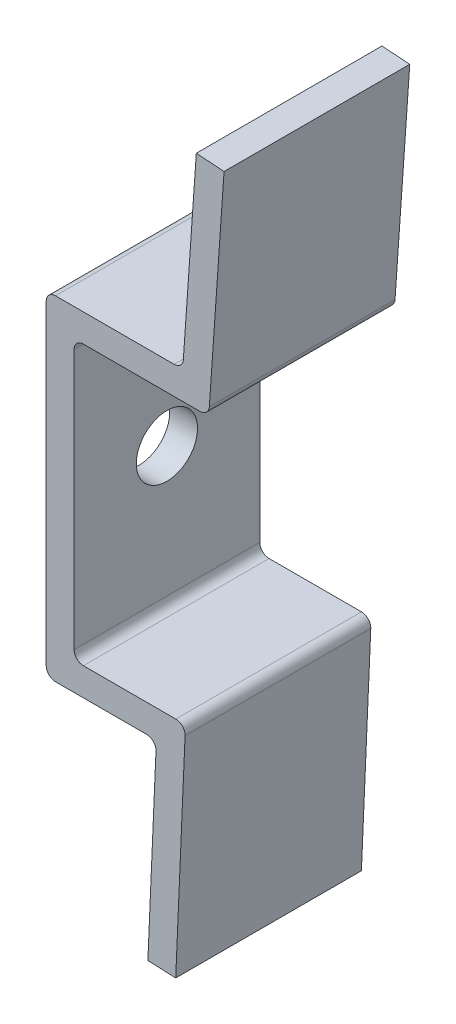
from build123d import *

# Parameters (mm, degrees)
EXTRUDE_1_DEPTH      = 10
EXTRUDE_1_DEPTH_BACK = 10
HOLE_WIZARD_M61_D    = 6.6


with BuildPart() as part:
    # Эскиз1 → Бобышка-Вытянуть1 (new, two sides: drawn at the far end of the back side and taken through both)
    with BuildSketch(Plane.XY.offset(-EXTRUDE_1_DEPTH_BACK)):
        with BuildLine():
            Line((0, 17), (0, -17))
            ThreePointArc((0, -17), (0.292893219, -17.707106781), (1, -18))
            Line((1, -18), (10.821545488, -18))
            ThreePointArc((10.821545488, -18), (11.54390945, -18.308486944), (11.820593709, -19.043619387))
            Line((11.820593709, -19.043619387), (10.948205962, -39.024583819))
            Line((10.948205962, -39.024583819), (13.945350627, -39.155441981))
            Line((13.945350627, -39.155441981), (14.954434594, -16.043619387))
            ThreePointArc((14.954434594, -16.043619387), (14.677750334, -15.308486944), (13.955386372, -15))
            Line((13.955386372, -15), (4, -15))
            ThreePointArc((4, -15), (3.292893219, -14.707106781), (3, -14))
            Line((3, -14), (3, 14))
            ThreePointArc((3, 14), (3.292893219, 14.707106781), (4, 15))
            Line((4, 15), (16.567484914, 15))
            ThreePointArc((16.567484914, 15), (17.249483274, 15.268646298), (17.565048964, 15.930243526))
            Line((17.565048964, 15.930243526), (19.155325331, 38.67225511))
            Line((19.155325331, 38.67225511), (16.162633181, 38.881524531))
            Line((16.162633181, 38.881524531), (14.767503706, 18.930243526))
            ThreePointArc((14.767503706, 18.930243526), (14.451938016, 18.268646298), (13.769939655, 18))
            Line((13.769939655, 18), (1, 18))
            ThreePointArc((1, 18), (0.292893219, 17.707106781), (0, 17))
        make_face()
    extrude(amount=EXTRUDE_1_DEPTH + EXTRUDE_1_DEPTH_BACK)

    # Отверстие с зазором M61 (through all)
    with Locations(Plane(origin=(0, 0, 0), x_dir=(0, -1, 0), z_dir=(-1, 0, 0))):
        with Locations((0, 0)):
            Hole(HOLE_WIZARD_M61_D / 2)


solid = part.part
